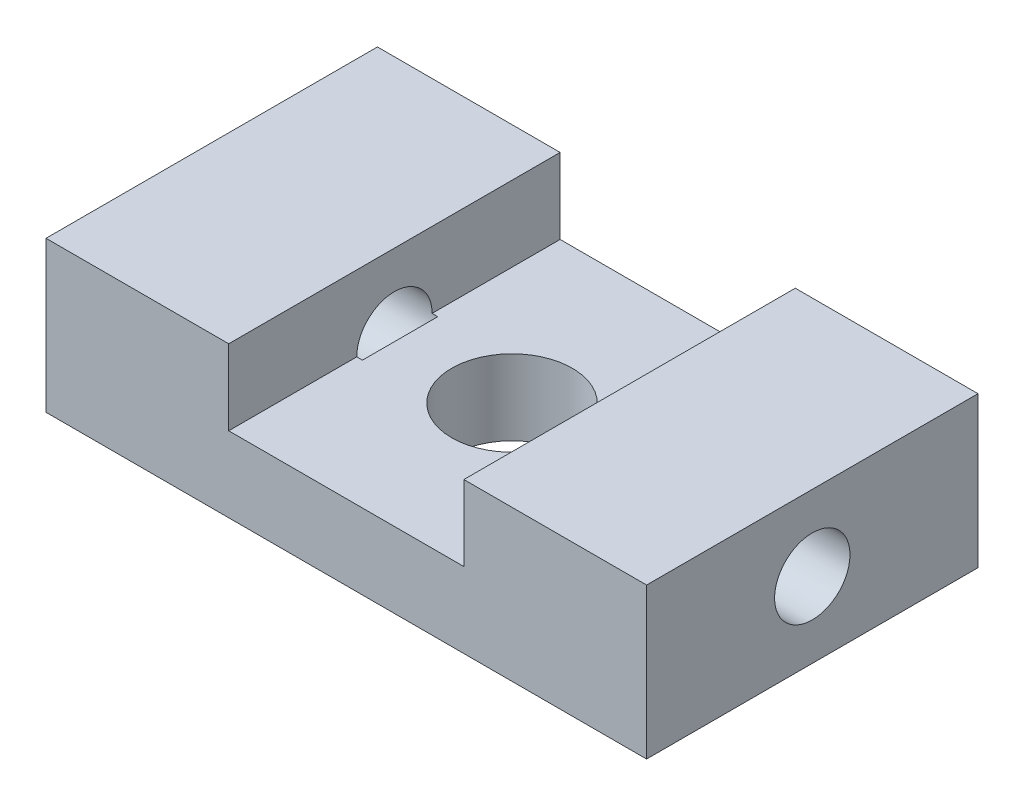
from build123d import *

# Parameters (mm, degrees)
SKETCH_1_W          = 79.688684702
SKETCH_1_H          = 43.973938876
SKETCH_1_R          = 8
EXTRUDE_1_DEPTH     = 20
SKETCH_2_R          = 5
CUT_EXTRUDE_2_DEPTH = 25
CUT_EXTRUDE_START   = -25
SKETCH_3_R          = 5
CUT_EXTRUDE_3_DEPTH = 25
SKETCH_4_W          = 31.2
SKETCH_4_H          = 50
CUT_EXTRUDE_4_DEPTH = 10


with BuildPart() as part:
    # Эскиз1 → Вытянуть1 (new body)
    with BuildSketch(Plane(origin=(0, 0, 0), x_dir=(1, 0, 0), z_dir=(0, 1, 0))):
        Rectangle(SKETCH_1_W, SKETCH_1_H)
        with Locations(Location((0, 0, 0), (0, 0, 270))):
            Circle(SKETCH_1_R, mode=Mode.SUBTRACT)
    extrude(amount=EXTRUDE_1_DEPTH)

    # Эскиз2 → Вытянуть2 (cut)
    with BuildSketch(Plane.ZY.offset(39.844342351)):
        with Locations((0, 10)):
            Circle(SKETCH_2_R)
    extrude(amount=-CUT_EXTRUDE_2_DEPTH, mode=Mode.SUBTRACT)

    # Эскиз3 → Вытянуть3 (cut)
    with BuildSketch(Plane(origin=(39.844342351, 0, 0), x_dir=(0, 0, -1), z_dir=(1, 0, 0)).offset(CUT_EXTRUDE_START)):
        with Locations(Location((0, 10, 0), (0, 0, 180))):
            Circle(SKETCH_3_R)
    extrude(amount=CUT_EXTRUDE_3_DEPTH, mode=Mode.SUBTRACT)

    # Эскиз4 → Вытянуть4 (cut)
    with BuildSketch(Plane(origin=(0, 20, 0), x_dir=(1, 0, 0), z_dir=(0, 1, 0))):
        Rectangle(SKETCH_4_W, SKETCH_4_H)
    extrude(amount=-CUT_EXTRUDE_4_DEPTH, mode=Mode.SUBTRACT)


solid = part.part
